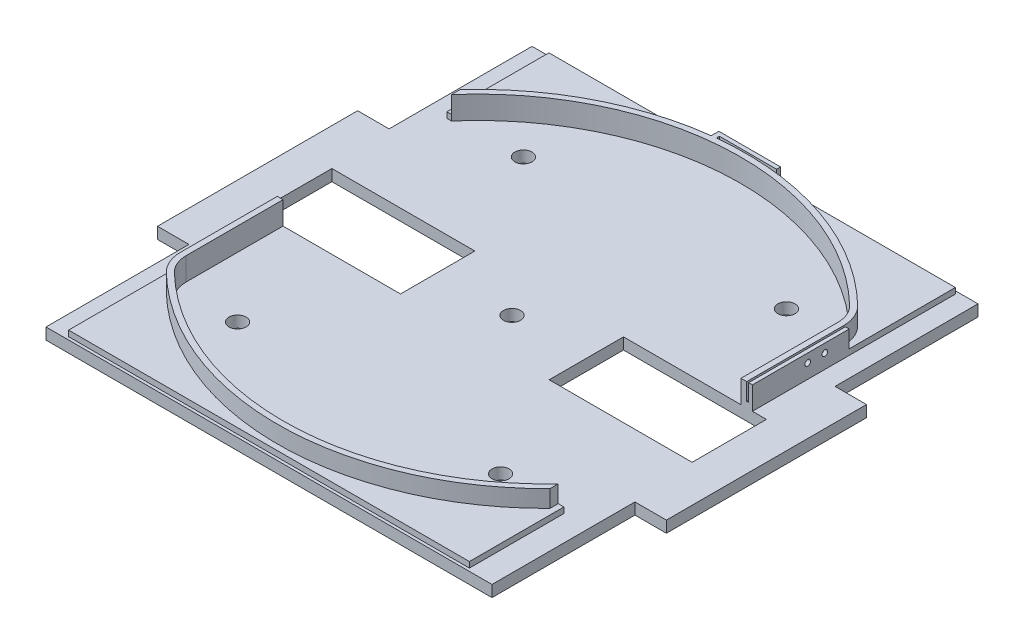
from build123d import *

# Parameters (mm, degrees)
BOSS_EXTRUDE1_DEPTH               = 2
BOSS_EXTRUDE2_DEPTH               = 4
BOSS_EXTRUDE3_DEPTH               = 1
BOSS_EXTRUDE4_DEPTH               = 3
SKETCH7_W                         = 13
SKETCH7_H                         = 25
CUT_EXTRUDE2_DEPTH                = 0.75
F_3_0_3_DIAMETER_HOLE1_D          = 3
SKETCH12_W                        = 0.5
SKETCH12_H                        = 1.222432211
F_1_0_1_DIAMETER_HOLE1_AT_2_COUNT = 2
F_1_0_1_DIAMETER_HOLE1_AT_2_PITCH = 2
F_1_0_1_DIAMETER_HOLE2_D          = 1
F_1_0_1_DIAMETER_HOLE2_DEPTH      = 3
SKETCH18_W                        = 25
SKETCH18_H                        = 13
CUT_EXTRUDE4_DEPTH                = 10
SKETCH19_W                        = 25
SKETCH19_H                        = 13
CUT_EXTRUDE5_DEPTH                = 62.758096635
SKETCH20_W                        = 0.67
SKETCH20_H                        = 16.929710607
BOSS_EXTRUDE5_DEPTH               = 3
F_1_0_1_DIAMETER_HOLE3_D          = 1
F_1_0_1_DIAMETER_HOLE3_DEPTH      = 3


with BuildPart() as part:
    # Sketch1 → Boss-Extrude1 (new body)
    with BuildSketch(Plane(origin=(0, 0, 0), x_dir=(1, 0, 0), z_dir=(0, 1, 0))):
        Polygon((17.5, 42.5), (-39, 42.5), (-39, 17.5), (-44.5, 17.5), (-44.5, -17.5), (-39, -17.5), (-39, -42.5), (17.5, -42.5), (39, -42.5), (39, -17.5), (44.5, -17.5), (44.5, 17.5), (39, 17.5), (39, 42.5), align=None)
    extrude(amount=BOSS_EXTRUDE1_DEPTH)

    # Sketch2 → Boss-Extrude2 (add)
    with BuildSketch(Plane(origin=(0, 2, 0), x_dir=(1, 0, 0), z_dir=(0, 1, 0))):
        with BuildLine():
            Line((34.546315587, 23.429710607), (34.546315587, 0))
            Line((34.546315587, 0), (33.546315587, 0))
            Line((33.546315587, 0), (33.546315587, 23.429710607))
            ThreePointArc((33.546315587, 23.429710607), (33.151002872, 25.378262634), (32.027573585, 27.018699705))
            ThreePointArc((32.027573585, 27.018699705), (-1.976971125, 39.957497595), (-34.744767591, 24.14632855))
            Line((-34.744767591, 24.14632855), (-34.744767591, 25.651242078))
            ThreePointArc((-34.744767591, 25.651242078), (-1.451938229, 40.977567789), (32.723825185, 27.736497525))
            ThreePointArc((32.723825185, 27.736497525), (34.071940329, 25.76797304), (34.546315587, 23.429710607))
        make_face()
        with BuildLine():
            Line((33.55, -26.915004177), (33.55, -25.470581501))
            ThreePointArc((33.55, -25.470581501), (1.082760633, -39.987255076), (-32.031707317, -27.014689554))
            ThreePointArc((-32.031707317, -27.014689554), (-33.154809257, -25.374400109), (-33.55, -23.426136342))
            Line((-33.55, -23.426136342), (-33.55, 0))
            Line((-33.55, 0), (-34.55, 0))
            Line((-34.55, 0), (-34.55, -23.426136342))
            ThreePointArc((-34.55, -23.426136342), (-34.075771108, -25.764052863), (-32.72804878, -27.732400197))
            ThreePointArc((-32.72804878, -27.732400197), (0.579599012, -40.996426087), (33.55, -26.915004177))
        make_face()
    extrude(amount=BOSS_EXTRUDE2_DEPTH)

    # Sketch3 → Boss-Extrude3 (add)
    with BuildSketch(Plane(origin=(0, 2, 0), x_dir=(1, 0, 0), z_dir=(0, 1, 0))):
        with BuildLine():
            Line((-35.546315587, 42), (35.546315587, 42))
            Line((35.546315587, 42), (35.546315587, 0))
            Line((35.546315587, 0), (34.546315587, 0))
            Line((34.546315587, 0), (34.546315587, 23.446970837))
            ThreePointArc((34.546315587, 23.446970837), (34.071801154, 25.777287901), (32.723825185, 27.736497525))
            ThreePointArc((32.723825185, 27.736497525), (-1.450164751, 40.920186771), (-34.744767591, 25.651242078))
            Line((-34.744767591, 25.651242078), (-34.744767591, 24.14632855))
            Line((-34.744767591, 24.14632855), (-35.546315587, 24.14632855))
            Line((-35.546315587, 24.14632855), (-35.546315587, 25.914938844))
            Line((-35.546315587, 25.914938844), (-35.546315587, 42))
        make_face()
        with BuildLine():
            Line((-35.55, -42), (34.55, -42))
            Line((34.55, -42), (34.55, -25.470581501))
            Line((34.55, -25.470581501), (33.55, -25.470581501))
            Line((33.55, -25.470581501), (33.55, -26.915004177))
            ThreePointArc((33.55, -26.915004177), (0.579599012, -40.996426087), (-32.72804878, -27.732400197))
            ThreePointArc((-32.72804878, -27.732400197), (-34.075771108, -25.764052863), (-34.55, -23.426136342))
            Line((-34.55, -23.426136342), (-34.55, 0))
            Line((-34.55, 0), (-35.55, 0))
            Line((-35.55, 0), (-35.55, -42))
        make_face()
    extrude(amount=BOSS_EXTRUDE3_DEPTH)

    # Sketch4 → Boss-Extrude4 (add)
    with BuildSketch(Plane(origin=(0, 3, 0), x_dir=(1, 0, 0), z_dir=(0, 1, 0))):
        Polygon((5, 41.977567789), (-5.8, 41.977567789), (-5.8, 40.077567789), (-5, 40.077567789), (-5, 41.277567789), (5, 41.277567789), align=None)
    extrude(amount=BOSS_EXTRUDE4_DEPTH)

    # Sketch7 → Cut-Extrude2 (cut)
    with BuildSketch(Plane.XZ):
        with Locations((0, -25.5)):
            Rectangle(SKETCH7_W, SKETCH7_H)
        with Locations((0, 25.5)):
            Rectangle(SKETCH7_W, SKETCH7_H)
    extrude(amount=-CUT_EXTRUDE2_DEPTH, mode=Mode.SUBTRACT)

    # Ø3.0 (3) Diameter Hole1 (through all)
    with Locations(Plane(origin=(0, 2, 0), x_dir=(1, 0, 0), z_dir=(0, 1, 0))):
        with Locations((-23, 25), (-23, -25), (23, -25), (23, 25), (0, 0)):
            Hole(F_3_0_3_DIAMETER_HOLE1_D / 2)

    # Sketch12 → Ø1.0 (1) Diameter Hole1 (revolve, cut)
    with BuildSketch(Plane(origin=(-3.7, 4.5, -41.277567789), x_dir=(0, -1, 0), z_dir=(1, 0, 0))):
        with Locations((0.25, 0.611216106)):
            Rectangle(SKETCH12_W, SKETCH12_H)
    f_1_0_1_diameter_hole1 = revolve(axis=Axis((-3.7, 4.5, -34.927567789), (0, 0, -1)), mode=Mode.SUBTRACT)

    # Ø1.0 (1) Diameter Hole1 at 2: Ø1.0 (1) Diameter Hole1 ×2
    with Locations(*[(i * F_1_0_1_DIAMETER_HOLE1_AT_2_PITCH, 0, 0) for i in range(1, F_1_0_1_DIAMETER_HOLE1_AT_2_COUNT)]):
        add(f_1_0_1_diameter_hole1, mode=Mode.SUBTRACT)

    # Ø1.0 (1) Diameter Hole2
    with Locations(Plane.ZY.offset(-33.546315587)):
        with Locations((-19.169710607, 4.5), (-16.169710607, 4.5)):
            Hole(F_1_0_1_DIAMETER_HOLE2_D / 2, depth=F_1_0_1_DIAMETER_HOLE2_DEPTH)

    # Sketch18 → Cut-Extrude4 (cut)
    with BuildSketch(Plane.XZ.offset(-0.75)):
        with Locations((-25.5, 0)):
            Rectangle(SKETCH18_W, SKETCH18_H)
        with Locations((25.5, 0)):
            Rectangle(SKETCH18_W, SKETCH18_H)
    extrude(amount=-CUT_EXTRUDE4_DEPTH, mode=Mode.SUBTRACT)

    # Sketch19 → Cut-Extrude5 (cut, through all)
    with BuildSketch(Plane(origin=(0, 0.75, 0), x_dir=(1, 0, 0), z_dir=(0, 1, 0))):
        with Locations((-25.5, 0)):
            Rectangle(SKETCH19_W, SKETCH19_H)
        with Locations((25.5, 0)):
            Rectangle(SKETCH19_W, SKETCH19_H)
    extrude(amount=-CUT_EXTRUDE5_DEPTH, mode=Mode.SUBTRACT)

    # Sketch20 → Boss-Extrude5 (add)
    with BuildSketch(Plane(origin=(0, 3, 0), x_dir=(1, 0, 0), z_dir=(0, 1, 0))):
        with Locations((35.211315587, 14.964855304)):
            Rectangle(SKETCH20_W, SKETCH20_H)
    extrude(amount=BOSS_EXTRUDE5_DEPTH)

    # Ø1.0 (1) Diameter Hole3
    with Locations(Plane.ZY.offset(-34.876315587)):
        with Locations((-19.169710607, 4.5), (-16.169710607, 4.5)):
            Hole(F_1_0_1_DIAMETER_HOLE3_D / 2, depth=F_1_0_1_DIAMETER_HOLE3_DEPTH)


solid = part.part
